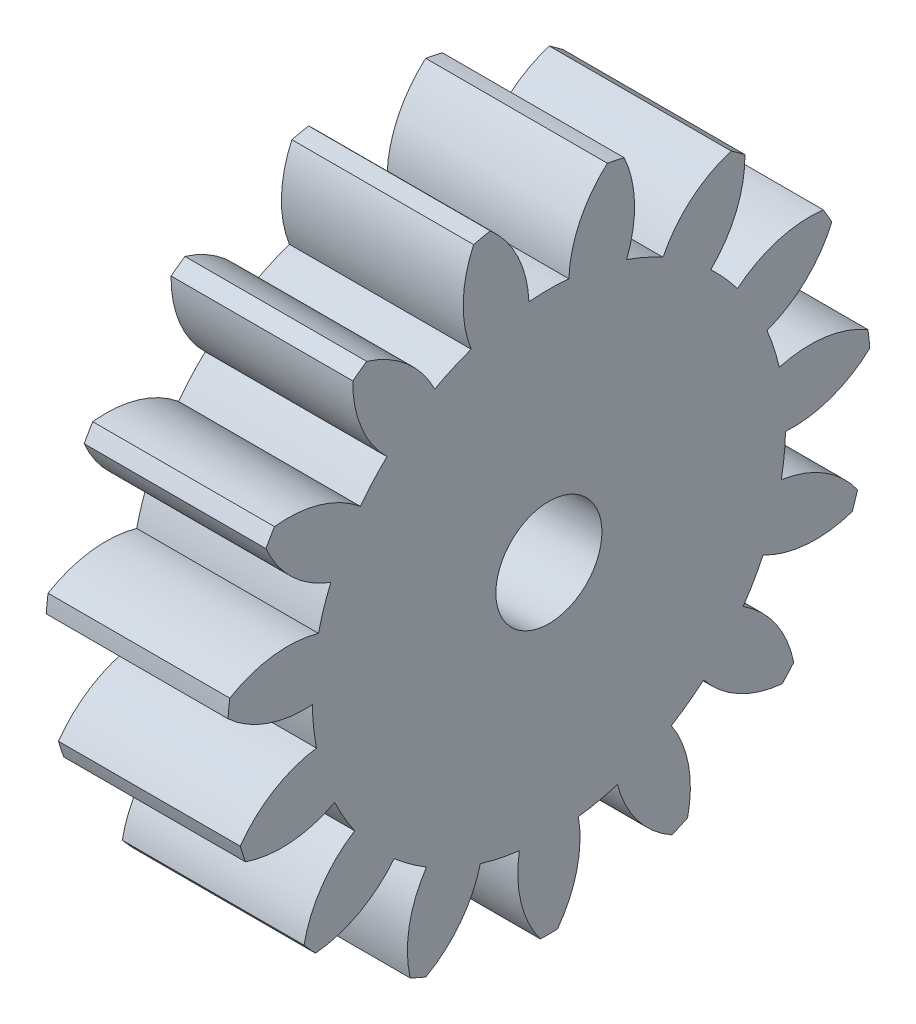
from build123d import *

# Parameters (mm, degrees)
BASPROSKE_W     = 12
BASPROSKE_H     = 21.25
TOOTHCUT_DEPTH  = 33.35931087
TEETHCUTS_COUNT = 15
TEETHCUTS_ANGLE = 336
BORSKE_R        = 3.5
BORE_DEPTH      = 50.0000508


with BuildPart() as part:
    # BasProSke → Base-Revolve (revolve)
    with BuildSketch(Plane(origin=(0, 0, 0), x_dir=(1, 0, 0), z_dir=(0, 1, 0)), mode=Mode.PRIVATE) as base_revolve_sk:
        with Locations((6, 10.625)):
            Rectangle(BASPROSKE_W, BASPROSKE_H)
    revolve(base_revolve_sk.sketch.rotate(Axis((-10, 0, 0), (1, 0, 0)), 180), axis=Axis((-10, 0, 0), (1, 0, 0)))

    # TooCutSke → ToothCut (cut, through all)
    with BuildSketch(Plane(origin=(0, 0, 0), x_dir=(0, 0, -1), z_dir=(1, 0, 0))):
        with BuildLine():
            ThreePointArc((1.317325472, 15.568366311), (0, 15.624), (-1.317325472, 15.568366311))
            ThreePointArc((-1.317325472, 15.568366311), (-2.05158513, 18.507838886), (-3.888921189, 20.916953343))
            ThreePointArc((-3.888921189, 20.916953343), (0, 21.2754), (3.888921189, 20.916953343))
            ThreePointArc((3.888921189, 20.916953343), (2.05158513, 18.507838886), (1.317325472, 15.568366311))
        make_face()
    toothcut = extrude(amount=TOOTHCUT_DEPTH, mode=Mode.SUBTRACT)

    # TeethCuts: ToothCut ×15 about axis
    teethcuts_axis = Axis((-10, 0, 0), (1, 0, 0))
    for i in range(1, TEETHCUTS_COUNT):
        add(toothcut.rotate(teethcuts_axis, i * TEETHCUTS_ANGLE / (TEETHCUTS_COUNT - 1)), mode=Mode.SUBTRACT)

    # BorSke → Bore (cut, symmetric)
    with BuildSketch(Plane(origin=(0, 0, 0), x_dir=(0, 0, -1), z_dir=(1, 0, 0))):
        with Locations(Location((0, 0, 0), (0, 0, 180))):
            Circle(BORSKE_R)
    extrude(amount=BORE_DEPTH, both=True, mode=Mode.SUBTRACT)


solid = part.part
